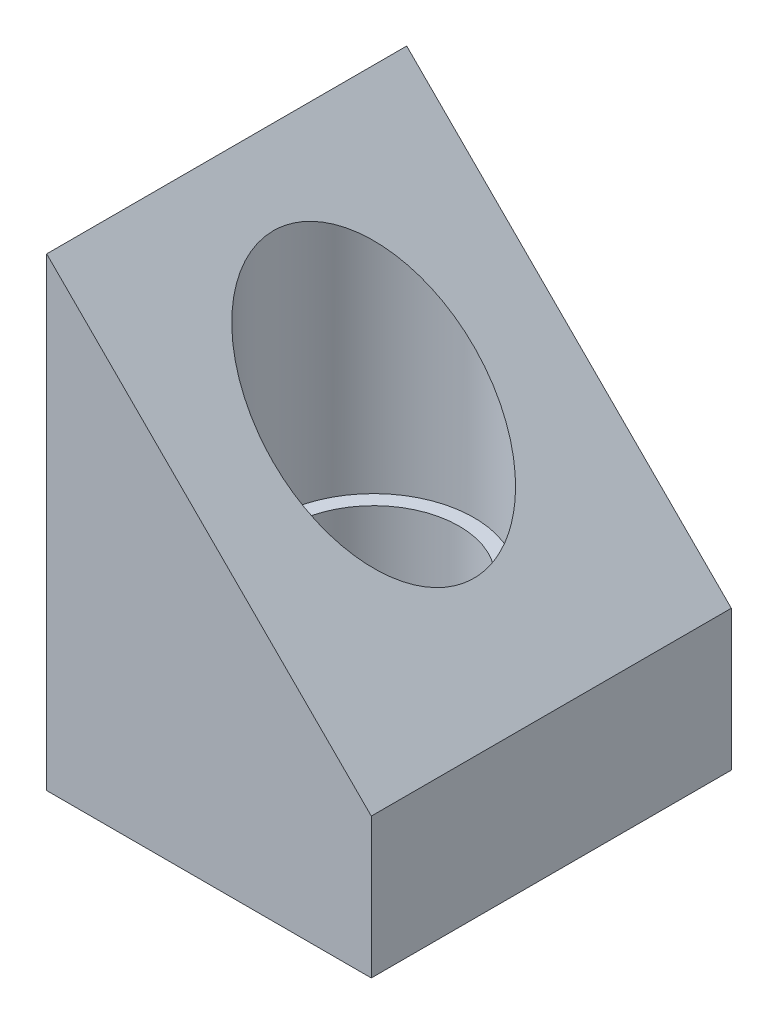
from build123d import *

# Parameters (mm, degrees)
SKETCH1_W           = 5.5
SKETCH1_H           = 6.1
BOSS_EXTRUDE1_DEPTH = 1
BOSS_EXTRUDE2_REACH = 60.527
SKETCH2_W           = 5.5
SKETCH2_H           = 6.1
SKETCH2_R           = 1.45
SKETCH3_R           = 1.7
CUT_EXTRUDE1_DEPTH  = 5


with BuildPart() as part:
    # Sketch1 → Boss-Extrude1 (new body)
    with BuildSketch(Plane(origin=(0, -13.3, 0), x_dir=(1, 0, 0), z_dir=(0, 1, 0))):
        with Locations((15.5, -52.55)):
            Rectangle(SKETCH1_W, SKETCH1_H)
    extrude(amount=BOSS_EXTRUDE1_DEPTH)

    # Boss-Extrude2: up to this plane
    boss_extrude2_end = Plane(origin=(18.287867966, -10.962132034, -41.256060161), z_dir=(0.7071067811865521, 0.707106781186543, 0))
    # Sketch2 → Boss-Extrude2 (add, up to the surface)
    with BuildSketch(Plane(origin=(0, -12.3, 0), x_dir=(1, 0, 0), z_dir=(0, 1, 0)), mode=Mode.PRIVATE) as boss_extrude2_sk1:
        with Locations((15.5, -52.55)):
            Rectangle(SKETCH2_W, SKETCH2_H)
        with Locations((15.24, -52.55)):
            Circle(SKETCH2_R, mode=Mode.SUBTRACT)
    boss_extrude2_tool1 = split(extrude(boss_extrude2_sk1.sketch, amount=BOSS_EXTRUDE2_REACH, mode=Mode.PRIVATE), bisect_by=boss_extrude2_end, keep=Keep.BOTH, mode=Mode.PRIVATE)
    add(boss_extrude2_tool1.solids().sort_by_distance((12.832134, -12.3, 52.55))[0])

    # Sketch3 → Cut-Extrude1 (cut)
    with BuildSketch(Plane(origin=(0, -5.424264069, 0), x_dir=(1, 0, 0), z_dir=(0, 1, 0))):
        with Locations(Location((15.24, -52.55, 0), (0, 0, 270))):
            Circle(SKETCH3_R)
    extrude(amount=-CUT_EXTRUDE1_DEPTH, mode=Mode.SUBTRACT)


solid = part.part
